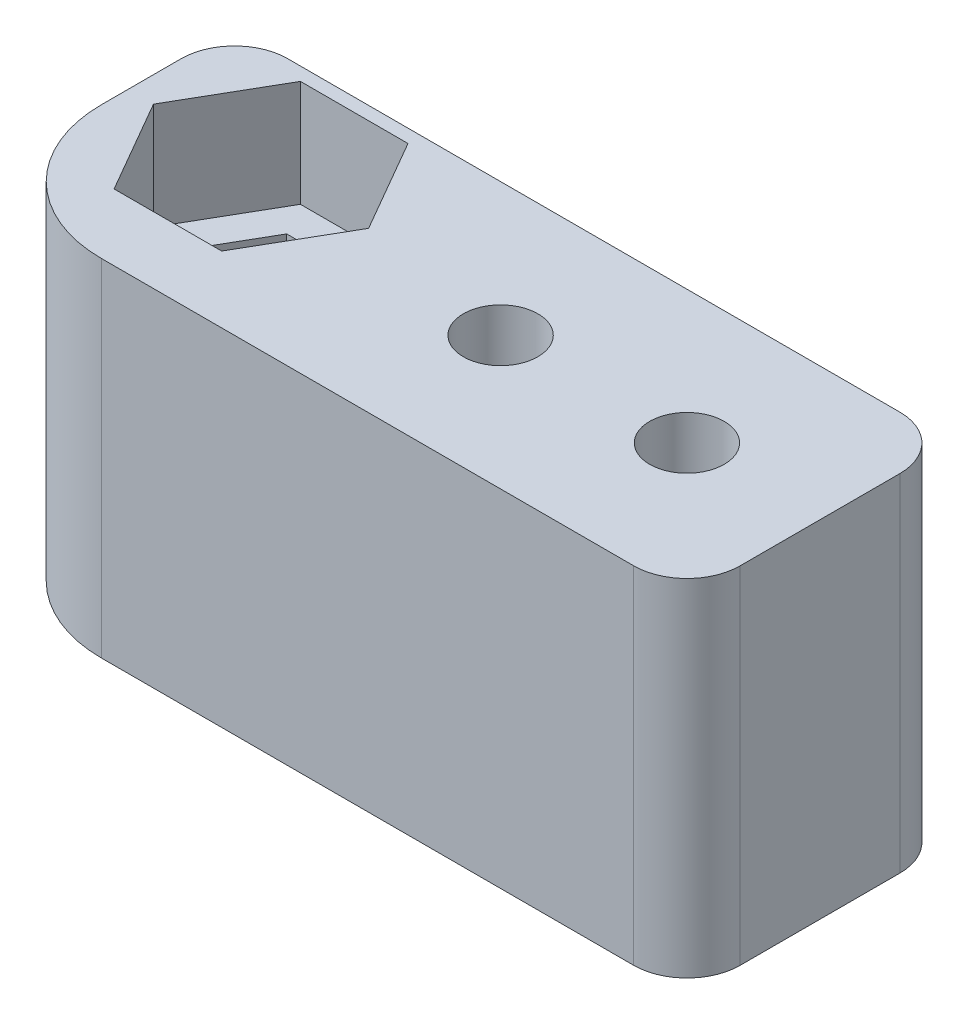
from build123d import *

# Parameters (mm, degrees)
SKETCH1_W           = 34.29
SKETCH1_H           = 12.7
SKETCH1_R           = 2.286
SKETCH1_R_2         = 1.778
BOSS_EXTRUDE1_DEPTH = 16.51
FILLET1_R           = 2.54
FILLET2_R           = 6.35
CUT_EXTRUDE2_DEPTH  = 5.08
CUT_EXTRUDE3_DEPTH  = 8.89


with BuildPart() as part:
    # Sketch1 → Boss-Extrude1 (new body)
    with BuildSketch(Plane(origin=(0, 0, 0), x_dir=(1, 0, 0), z_dir=(0, 1, 0))):
        with Locations((-1.905, 0)):
            Rectangle(SKETCH1_W, SKETCH1_H)
        with Locations(Location((-12.7, 1.27, 0), (0, 0, 270))):
            Circle(SKETCH1_R, mode=Mode.SUBTRACT)
        with Locations(Location((0, 0, 0), (0, 0, 270))):
            Circle(SKETCH1_R_2, mode=Mode.SUBTRACT)
        with Locations(Location((8.89, 0, 0), (0, 0, 270))):
            Circle(SKETCH1_R_2, mode=Mode.SUBTRACT)
    extrude(amount=BOSS_EXTRUDE1_DEPTH)

    # Fillet1
    fillet1_edges = [part.edges().sort_by_distance(p)[0] for p in [
        (-19.05, 8.255, -6.35),
        (15.24, 8.255, -6.35),
        (15.24, 8.255, 6.35),
    ]]
    fillet(fillet1_edges, radius=FILLET1_R)

    # Fillet2
    fillet2_edges = [part.edges().sort_by_distance(p)[0] for p in [
        (-19.05, 8.255, 6.35),
    ]]
    fillet(fillet2_edges, radius=FILLET2_R)

    # Sketch4 → Cut-Extrude2 (cut)
    with BuildSketch(Plane(origin=(0, 16.51, 0), x_dir=(1, 0, 0), z_dir=(0, 1, 0))):
        Polygon((-7.567356107, 1.27), (-10.133678053, 5.715), (-15.266321947, 5.715), (-17.832643893, 1.27), (-15.266321947, -3.175), (-10.133678053, -3.175), align=None)
    extrude(amount=-CUT_EXTRUDE2_DEPTH, mode=Mode.SUBTRACT)

    # Sketch5 → Cut-Extrude3 (cut)
    with BuildSketch(Plane(origin=(0, 11.43, 0), x_dir=(1, 0, 0), z_dir=(0, 1, 0))):
        Polygon((-9.356438934, 1.27), (-11.028219467, 4.165608823), (-14.371780533, 4.165608823), (-16.043561066, 1.27), (-14.371780533, -1.625608823), (-11.028219467, -1.625608823), align=None)
    extrude(amount=-CUT_EXTRUDE3_DEPTH, mode=Mode.SUBTRACT)


solid = part.part
